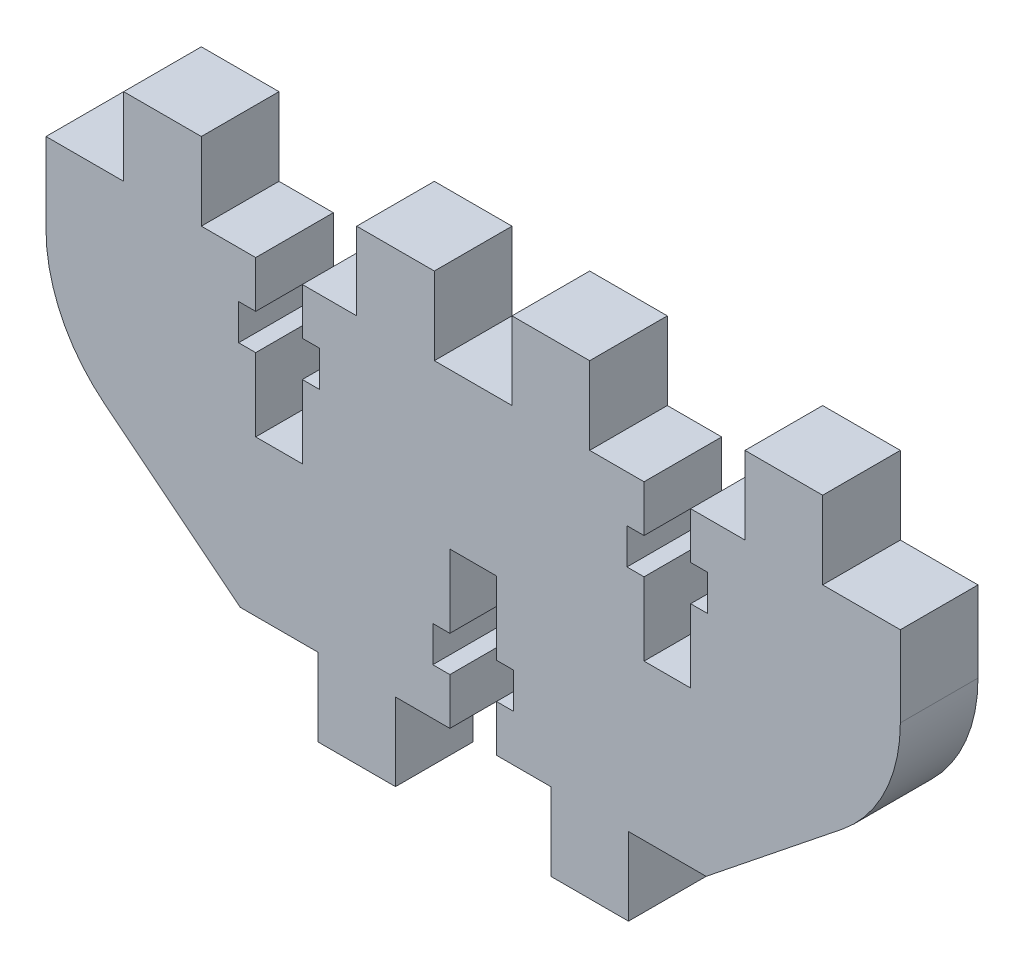
from build123d import *

# Parameters (mm, degrees)
BOSS_EXTRU_1_DEPTH = 5
CONG_1_R           = 10


with BuildPart() as part:
    # Esquisse1 → Boss.-Extru.1 (new body)
    with BuildSketch(Plane.XY):
        Polygon((-10, 0), (-15, 0), (-27.5, 10), (-27.5, 20), (-22.5, 20), (-22.5, 25), (-17.5, 25), (-17.5, 20), (-14, 20), (-14, 17), (-15.1, 17), (-15.1, 14.7), (-14, 14.7), (-14, 10), (-11, 10), (-11, 14.7), (-9.9, 14.7), (-9.9, 17), (-11, 17), (-11, 20), (-7.5, 20), (-7.5, 25), (-2.5, 25), (-2.5, 20), (2.5, 20), (2.5, 25), (7.5, 25), (7.5, 20), (11, 20), (11, 17), (9.9, 17), (9.9, 14.7), (11, 14.7), (11, 10), (14, 10), (14, 14.7), (15.1, 14.7), (15.1, 17), (14, 17), (14, 20), (17.5, 20), (17.5, 25), (22.5, 25), (22.5, 20), (27.5, 20), (27.5, 10), (15, 0), (10, 0), (10, -5), (5, -5), (5, 0), (1.5, 0), (1.5, 3), (2.6, 3), (2.6, 5.3), (1.5, 5.3), (1.5, 10), (-1.5, 10), (-1.5, 5.3), (-2.6, 5.3), (-2.6, 3), (-1.5, 3), (-1.5, 0), (-5, 0), (-5, -5), (-10, -5), align=None)
    extrude(amount=BOSS_EXTRU_1_DEPTH)

    # Congé1
    cong_1_edges = [part.edges().sort_by_distance(p)[0] for p in [
        (27.5, 10, 2.5),
        (-27.5, 10, 2.5),
    ]]
    fillet(cong_1_edges, radius=CONG_1_R)


solid = part.part
